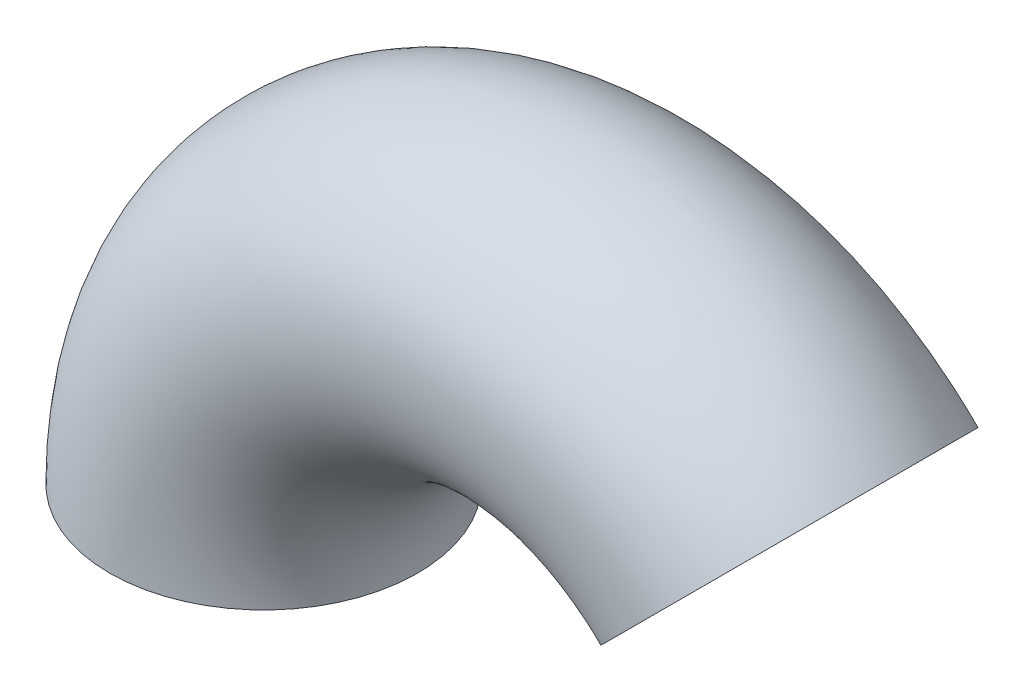
from build123d import *

# Parameters (mm, degrees)
SKETCH2_R = 23.749
SHELL1_T  = -2.54


with BuildPart() as part:
    # Sweep3: sweep along a path in Sketch1
    with BuildLine(Plane.XY) as sweep3_path:
        ThreePointArc((0, 0), (29.32130233, 43.882430035), (81.084157893, 33.586157893))
    # Sketch2 → Sweep3 (sweep)
    with BuildSketch(Plane(origin=(0, 0, 0), x_dir=(1, 0, 0), z_dir=(0, 1, 0))):
        Circle(SKETCH2_R)
    sweep(path=sweep3_path.line)

    # Shell1
    shell1_openings = [part.faces().sort_by_distance(p)[0] for p in [
        (81.084157893, 33.586157893, 0),
        (0, 0, 0),
    ]]
    offset(amount=SHELL1_T, openings=shell1_openings, kind=Kind.INTERSECTION)


solid = part.part
